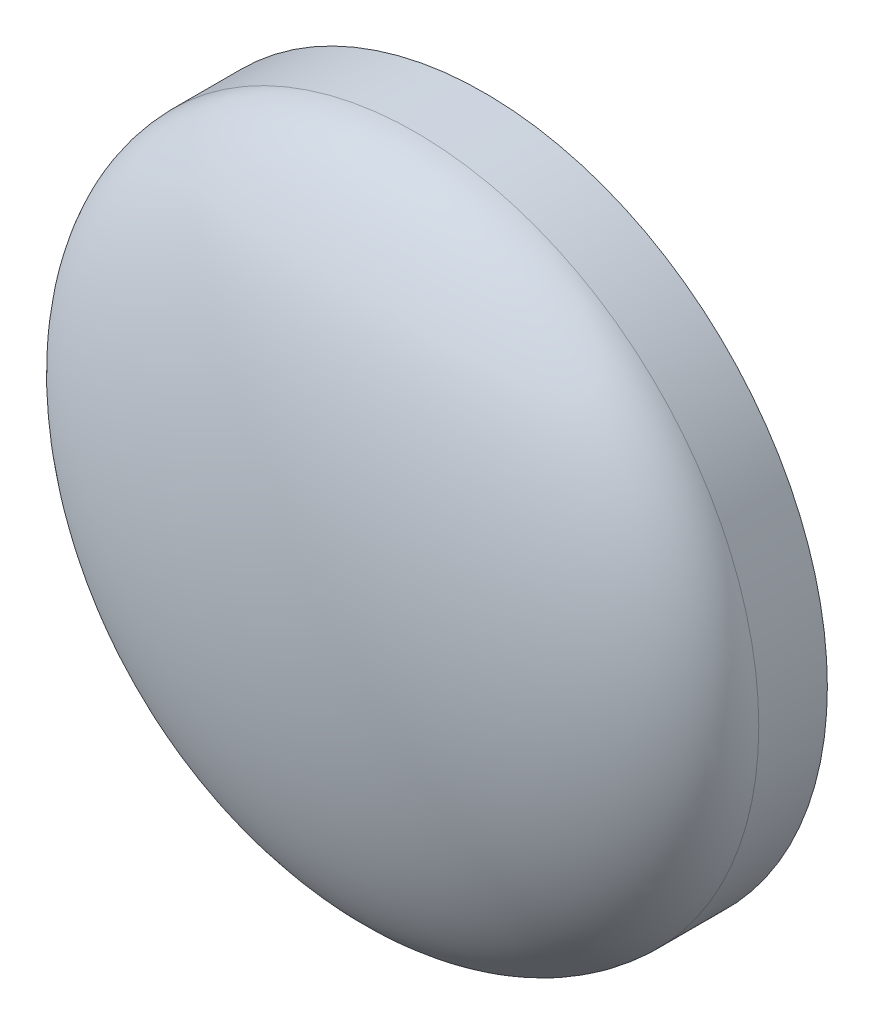
from build123d import *

# Parameters (mm, degrees)
ESQUISSE3_R             = 25
BOSS_EXTRU_5_DEPTH      = 5
ENL_V_MAT_EXTRU_2_DEPTH = 3
D_ME1_FACE_RADIUS       = 25
D_ME1_HEIGHT            = 10


with BuildPart() as part:
    # Esquisse3 → Boss.-Extru.5 (new body)
    with BuildSketch(Plane.XY):
        with Locations((3.046572579, -1.457056451)):
            Circle(ESQUISSE3_R)
    extrude(amount=BOSS_EXTRU_5_DEPTH)

    # Esquisse3<4> → Enlèv. mat.-Extru.2 (cut)
    with BuildSketch(Plane.XY):
        with BuildLine():
            ThreePointArc((18.793687386, -7.261700531), (18.786012776, -6.896288595), (18.531758174, -6.633725498))
            Line((18.531758174, -6.633725498), (15.180804122, -5.107799435))
            ThreePointArc((15.180804122, -5.107799435), (15.082182303, -5.009778343), (15.071293632, -4.871157152))
            ThreePointArc((15.071293632, -4.871157152), (-8.32750686, 3.727566671), (13.51100284, -8.294139112))
            ThreePointArc((13.51100284, -8.294139112), (13.623809877, -8.211136397), (13.763402917, -8.222479303))
            Line((13.763402917, -8.222479303), (17.087320205, -9.782411277))
            ThreePointArc((17.087320205, -9.782411277), (17.454023729, -9.805380714), (17.737416335, -9.571526697))
            ThreePointArc((17.737416335, -9.571526697), (18.309310033, -8.43662399), (18.793687386, -7.261700531))
        make_face()
    extrude(amount=ENL_V_MAT_EXTRU_2_DEPTH, mode=Mode.SUBTRACT)

    # Dôme1: an elliptical dome of height H over a round flat face of radius A is half a spheroid: the quarter ellipse of half axes A and H revolved about the face's axis
    with BuildSketch(Plane((3.046572579, -1.457056451, 5), x_dir=(0, 1, 0), z_dir=(1, 0, 0)), mode=Mode.PRIVATE) as d_me1_quarter:
        Ellipse(D_ME1_FACE_RADIUS, D_ME1_HEIGHT)
        Rectangle(D_ME1_FACE_RADIUS, D_ME1_HEIGHT, align=(Align.MIN, Align.MIN), mode=Mode.INTERSECT)
    revolve(d_me1_quarter.sketch, axis=Axis((3.046572579, -1.457056451, 5), (0, 0, 1)))


solid = part.part
